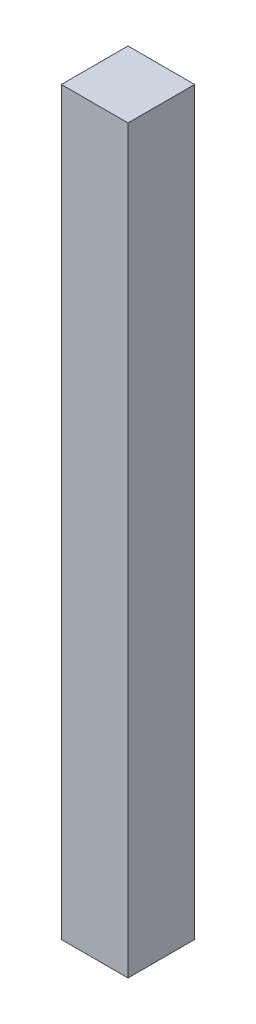
from build123d import *

# Parameters (mm, degrees)
TOPPING_KLAPE_KAT1_GAZLI_AMORTISOR_1_1_START = 8
SKETCH1_W                                    = 18
SKETCH1_H                                    = 200
TOPPING_KLAPE_KAT1_GAZLI_AMORTISOR_1_1_DEPTH = 18


with BuildPart() as part:
    # Sketch1 → TOPPING_klape_kat1_gazli_amortisor_1_1 (new body)
    with BuildSketch(Plane.XY.offset(TOPPING_KLAPE_KAT1_GAZLI_AMORTISOR_1_1_START)):
        with Locations((54, 1690)):
            Rectangle(SKETCH1_W, SKETCH1_H)
    extrude(amount=TOPPING_KLAPE_KAT1_GAZLI_AMORTISOR_1_1_DEPTH)


solid = part.part
